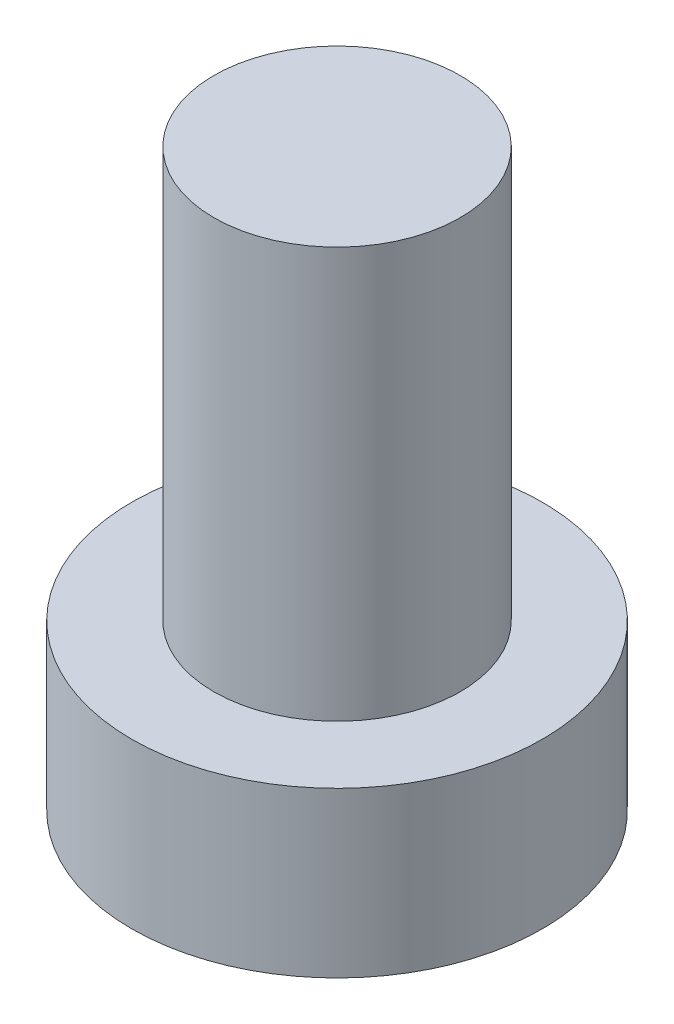
from build123d import *

# Parameters (mm, degrees)
SKETCH1_R           = 5
BOSS_EXTRUDE1_DEPTH = 14
CUT_EXTRUDE1_START  = -10
SKETCH2_R           = 5
SKETCH2_R_2         = 3
CUT_EXTRUDE1_DEPTH  = 10


with BuildPart() as part:
    # Sketch1 → Boss-Extrude1 (new body)
    with BuildSketch(Plane(origin=(0, 0, 0), x_dir=(-1, 0, 0), z_dir=(0, 1, 0))):
        with Locations(Location((0, 0, 0), (0, 0, 90))):
            Circle(SKETCH1_R)
    extrude(amount=BOSS_EXTRUDE1_DEPTH)

    # Sketch2 → Cut-Extrude1 (cut)
    with BuildSketch(Plane(origin=(0, 14, 0), x_dir=(-1, 0, 0), z_dir=(0, 1, 0)).offset(CUT_EXTRUDE1_START)):
        with Locations(Location((0, 0, 0), (0, 0, 90))):
            Circle(SKETCH2_R)
        with Locations(Location((0, 0, 0), (0, 0, 90))):
            Circle(SKETCH2_R_2, mode=Mode.SUBTRACT)
    extrude(amount=CUT_EXTRUDE1_DEPTH, mode=Mode.SUBTRACT)


solid = part.part
